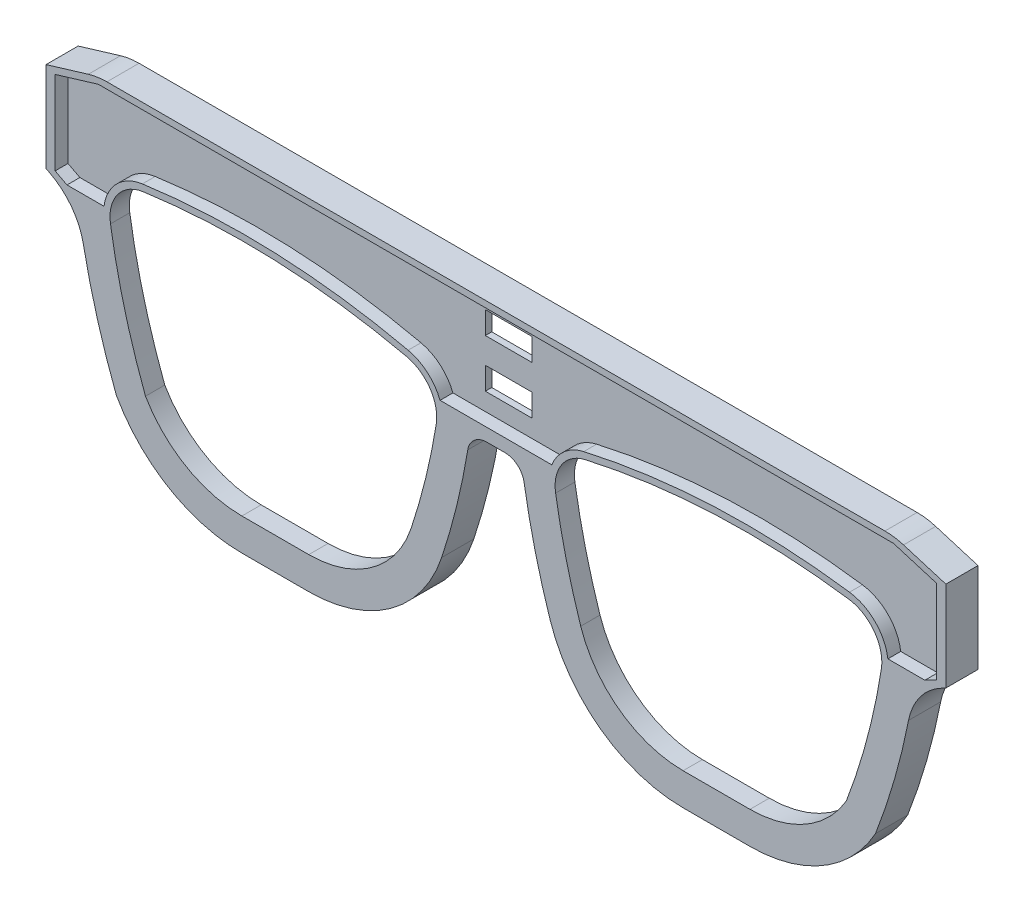
from build123d import *

# Parameters (mm, degrees)
BOSS_EXTRUDE1_DEPTH  = 5
CUT_EXTRUDE1_DEPTH   = 78.98076686
FILLET1_R            = 6
FILLET4_R            = 3
FILLET5_R            = 10
FILLET1_OF_MIRROR2_R = 6
FILLET4_OF_MIRROR2_R = 3
FILLET5_OF_MIRROR2_R = 10
CUT_EXTRUDE2_DEPTH   = 2
SKETCH4_W            = 7.3
SKETCH4_H            = 3.5
CUT_EXTRUDE3_DEPTH   = 78.878110027
CUT_EXTRUDE4_START   = -1
CUT_EXTRUDE4_DEPTH   = 2


with BuildPart() as part:
    # Sketch1 → Boss-Extrude1 (new body)
    with BuildSketch(Plane.XY):
        with BuildLine():
            Line((-70, 16.58258549), (-70, 2.58258549))
            Line((-70, 2.58258549), (-65, -0.035347018))
            ThreePointArc((-65, -0.035347018), (-62.639321295, -11.428715409), (-59.057390955, -22.499009997))
            ThreePointArc((-59.057390955, -22.499009997), (-50.858075368, -30.911196539), (-39.524366721, -34))
            Line((-39.524366721, -34), (-29.119439011, -34))
            ThreePointArc((-29.119439011, -34), (-16.364659062, -29.873537236), (-8.443933007, -19.058075838))
            ThreePointArc((-8.443933007, -19.058075838), (-5.792248942, -9.629238804), (-4, 0))
            Line((-4, 0), (0, 0))
            Line((0, 0), (0, 19))
            Line((0, 19), (-62, 19))
            Line((-62, 19), (-70, 16.58258549))
        make_face()
    boss_extrude1 = extrude(amount=BOSS_EXTRUDE1_DEPTH)

    # Sketch2 → Cut-Extrude1 (cut, through all)
    with BuildSketch(Plane.XY.offset(5)):
        with BuildLine():
            Line((-39.524366721, -29), (-29.119439011, -29))
            ThreePointArc((-29.119439011, -29), (-19.293350153, -25.821035725), (-13.191343035, -17.488968441))
            ThreePointArc((-13.191343035, -17.488968441), (-10.661621804, -8.493805879), (-8.951806424, 0.692541077))
            ThreePointArc((-8.951806424, 0.692541077), (-8.83111114, 2.375291538), (-8.93749946, 4.05900707))
            ThreePointArc((-8.93749946, 4.05900707), (-33.987475013, 7.999161751), (-59.288689209, 6.303681198))
            ThreePointArc((-59.288689209, 6.303681198), (-60.075532666, 3.563074376), (-60.056140486, 0.711816353))
            ThreePointArc((-60.056140486, 0.711816353), (-57.852345066, -9.972645379), (-54.521869403, -20.361214511))
            ThreePointArc((-54.521869403, -20.361214511), (-48.178176596, -26.685865227), (-39.524366721, -29))
        make_face()
    cut_extrude1 = extrude(amount=-CUT_EXTRUDE1_DEPTH, mode=Mode.SUBTRACT)

    # Fillet1
    fillet1_edges = [part.edges().sort_by_distance(p)[0] for p in [
        (-8.93749946, 4.05900707, 2.5),
        (-59.288689209, 6.303681198, 2.5),
    ]]
    fillet(fillet1_edges, radius=FILLET1_R)

    # Fillet4
    fillet4_edges = [part.edges().sort_by_distance(p)[0] for p in [
        (-4, 0, 2.5),
    ]]
    fillet(fillet4_edges, radius=FILLET4_R)

    # Fillet5
    fillet5_edges = [part.edges().sort_by_distance(p)[0] for p in [
        (-65, -0.035347018, 2.5),
        (-62, 19, 2.5),
    ]]
    fillet(fillet5_edges, radius=FILLET5_R)

    # Mirror2: Boss-Extrude1, Cut-Extrude1 across plane
    add(boss_extrude1.mirror(Plane(origin=(0, 19, 5), x_dir=(0, 0, 1), z_dir=(1, 0, 0))))
    add(cut_extrude1.mirror(Plane(origin=(0, 19, 5), x_dir=(0, 0, 1), z_dir=(1, 0, 0))), mode=Mode.SUBTRACT)

    # Fillet1 of Mirror2
    fillet1_of_mirror2_edges = [part.edges().sort_by_distance(p)[0] for p in [
        (8.93749946, 4.05900707, 2.5),
        (59.288689209, 6.303681198, 2.5),
    ]]
    fillet(fillet1_of_mirror2_edges, radius=FILLET1_OF_MIRROR2_R)

    # Fillet4 of Mirror2
    fillet4_of_mirror2_edges = [part.edges().sort_by_distance(p)[0] for p in [
        (4, 0, 2.5),
    ]]
    fillet(fillet4_of_mirror2_edges, radius=FILLET4_OF_MIRROR2_R)

    # Fillet5 of Mirror2
    fillet5_of_mirror2_edges = [part.edges().sort_by_distance(p)[0] for p in [
        (65, -0.035347018, 2.5),
        (62, 19, 2.5),
    ]]
    fillet(fillet5_of_mirror2_edges, radius=FILLET5_OF_MIRROR2_R)

    # Sketch3 → Cut-Extrude2 (cut)
    with BuildSketch(Plane.XY.offset(5)):
        with BuildLine():
            Line((-61.852211578, 18), (-68.579000582, 15.967320332))
            Line((-68.579000582, 15.967320332), (-68.579000582, 2.967348727))
            Line((-68.579000582, 2.967348727), (-66.731457293, 2))
            Line((-66.731457293, 2), (-60.978148267, 2))
            ThreePointArc((-60.978148267, 2), (-59.004204322, 6.004331826), (-55.011184694, 8.001059729))
            ThreePointArc((-55.011184694, 8.001059729), (-34.257732376, 9.011771002), (-13.66121584, 6.271182212))
            ThreePointArc((-13.66121584, 6.271182212), (-10.64537641, 4.753154175), (-8.690935653, 2))
            Line((-8.690935653, 2), (-4.382114171, 2))
            Line((-4.382114171, 2), (0, 2))
            Line((0, 2), (0, 18))
            Line((0, 18), (-61.852211578, 18))
        make_face()
        with BuildLine():
            Line((61.852211578, 18), (0, 18))
            Line((0, 18), (0, 2))
            Line((0, 2), (4.382114171, 2))
            Line((4.382114171, 2), (8.690935653, 2))
            ThreePointArc((8.690935653, 2), (10.64537641, 4.753154175), (13.66121584, 6.271182212))
            ThreePointArc((13.66121584, 6.271182212), (34.257732376, 9.011771002), (55.011184694, 8.001059729))
            ThreePointArc((55.011184694, 8.001059729), (59.004204322, 6.004331826), (60.978148267, 2))
            Line((60.978148267, 2), (66.731457293, 2))
            Line((66.731457293, 2), (68.579000582, 2.967348727))
            Line((68.579000582, 2.967348727), (68.579000582, 15.967320332))
            Line((68.579000582, 15.967320332), (61.852211578, 18))
        make_face()
    extrude(amount=-CUT_EXTRUDE2_DEPTH, mode=Mode.SUBTRACT)

    # Sketch4 → Cut-Extrude3 (cut, through all)
    with BuildSketch(Plane.XY.offset(3)):
        with Locations((0, 14)):
            Rectangle(SKETCH4_W, SKETCH4_H)
        with Locations((0, 6.5)):
            Rectangle(SKETCH4_W, SKETCH4_H)
    extrude(amount=-CUT_EXTRUDE3_DEPTH, mode=Mode.SUBTRACT)

    # Sketch6 → Cut-Extrude4 (cut)
    with BuildSketch(Plane.XY.offset(3).offset(CUT_EXTRUDE4_START)):
        with BuildLine():
            Line((69, 15.840104069), (63.125446932, 17.615257798))
            ThreePointArc((63.125446932, 17.615257798), (61.837919684, 17.903294901), (60.522115781, 18))
            Line((60.522115781, 18), (-60.522115781, 18))
            ThreePointArc((-60.522115781, 18), (-61.837919684, 17.903294901), (-63.125446932, 17.615257798))
            Line((-63.125446932, 17.615257798), (-69, 15.840104069))
            Line((-69, 15.840104069), (-69, 3.18777834))
            Line((-69, 3.18777834), (-68.903213495, 3.137102232))
            ThreePointArc((-68.903213495, 3.137102232), (-65.190574761, -0.027998941), (-63.211910581, -4.487420414))
            ThreePointArc((-63.211910581, -4.487420414), (-61.060268821, -13.390129723), (-58.149320801, -22.074263356))
            ThreePointArc((-58.149320801, -22.074263356), (-50.3209013, -30.066984302), (-39.524366721, -33))
            Line((-39.524366721, -33), (-29.119439011, -33))
            ThreePointArc((-29.119439011, -33), (-16.95039728, -29.063036934), (-9.393415013, -18.744254359))
            ThreePointArc((-9.393415013, -18.744254359), (-7.059487639, -10.627794467), (-5.368651351, -2.353423746))
            ThreePointArc((-5.368651351, -2.353423746), (-4.01101304, 0.048467239), (-1.421254848, 1))
            Line((-1.421254848, 1), (1.421254848, 1))
            ThreePointArc((1.421254848, 1), (4.01101304, 0.048467239), (5.368651351, -2.353423746))
            ThreePointArc((5.368651351, -2.353423746), (7.059487639, -10.627794467), (9.393415013, -18.744254359))
            ThreePointArc((9.393415013, -18.744254359), (16.95039728, -29.063036934), (29.119439011, -33))
            Line((29.119439011, -33), (39.524366721, -33))
            ThreePointArc((39.524366721, -33), (50.3209013, -30.066984302), (58.149320801, -22.074263356))
            ThreePointArc((58.149320801, -22.074263356), (61.060268821, -13.390129723), (63.211910581, -4.487420414))
            ThreePointArc((63.211910581, -4.487420414), (65.190574761, -0.027998941), (68.903213495, 3.137102232))
            Line((68.903213495, 3.137102232), (69, 3.18777834))
            Line((69, 3.18777834), (69, 15.840104069))
        make_face()
        with BuildLine():
            Line((39.524366721, -29), (29.119439011, -29))
            ThreePointArc((29.119439011, -29), (19.293350153, -25.821035725), (13.191343035, -17.488968441))
            ThreePointArc((13.191343035, -17.488968441), (10.920912078, -9.579342567), (9.284744219, -1.514604944))
            ThreePointArc((9.284744219, -1.514604944), (10.234661813, 2.801128318), (13.882135009, 5.295890091))
            ThreePointArc((13.882135009, 5.295890091), (34.299530853, 8.01264494), (54.872497662, 7.010723469))
            ThreePointArc((54.872497662, 7.010723469), (58.860128117, 4.642217415), (59.967820133, 0.138437228))
            ThreePointArc((59.967820133, 0.138437228), (57.77826599, -10.253097668), (54.521869403, -20.361214511))
            ThreePointArc((54.521869403, -20.361214511), (48.178176596, -26.685865227), (39.524366721, -29))
        make_face(mode=Mode.SUBTRACT)
        with BuildLine():
            Line((-39.524366721, -29), (-29.119439011, -29))
            ThreePointArc((-29.119439011, -29), (-19.293350153, -25.821035725), (-13.191343035, -17.488968441))
            ThreePointArc((-13.191343035, -17.488968441), (-10.920912078, -9.579342567), (-9.284744219, -1.514604944))
            ThreePointArc((-9.284744219, -1.514604944), (-10.234661813, 2.801128318), (-13.882135009, 5.295890091))
            ThreePointArc((-13.882135009, 5.295890091), (-34.299530853, 8.01264494), (-54.872497662, 7.010723469))
            ThreePointArc((-54.872497662, 7.010723469), (-58.860128117, 4.642217415), (-59.967820133, 0.138437228))
            ThreePointArc((-59.967820133, 0.138437228), (-57.77826599, -10.253097668), (-54.521869403, -20.361214511))
            ThreePointArc((-54.521869403, -20.361214511), (-48.178176596, -26.685865227), (-39.524366721, -29))
        make_face(mode=Mode.SUBTRACT)
    extrude(amount=-CUT_EXTRUDE4_DEPTH, mode=Mode.SUBTRACT)


solid = part.part
